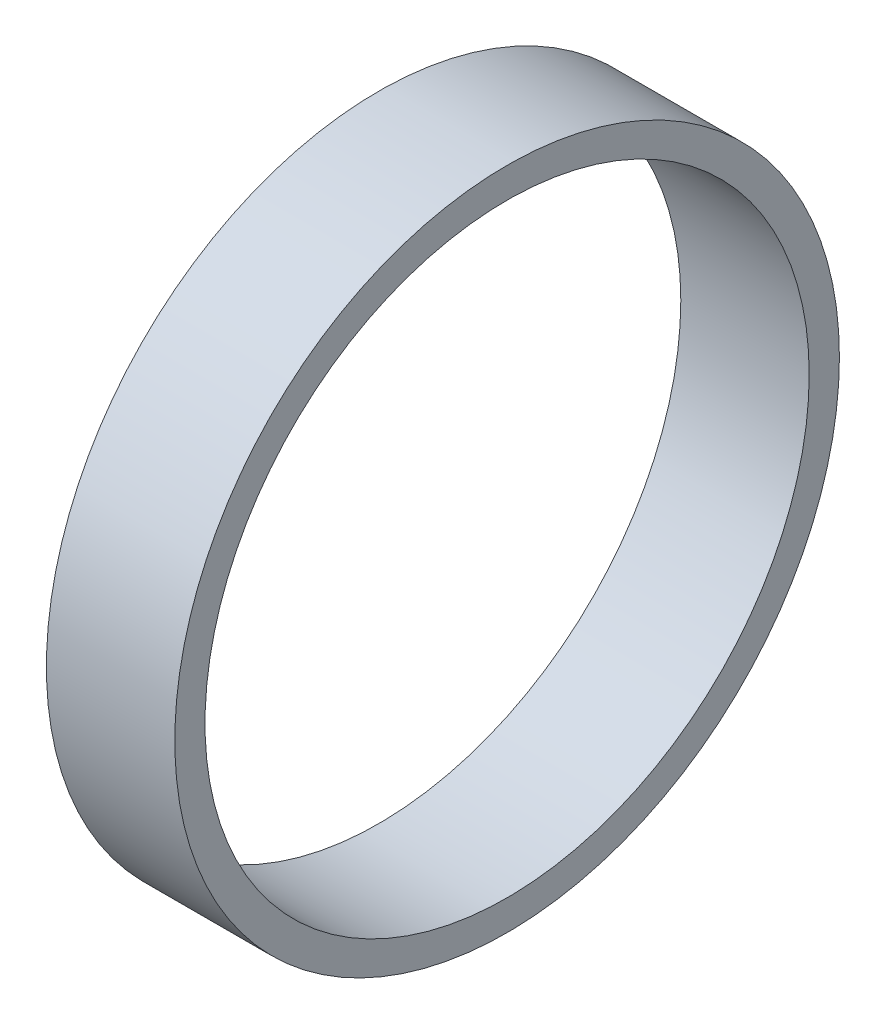
from build123d import *

# Parameters (mm, degrees)
ESBO_O1_R                = 11
ESBO_O1_R_2              = 10
RESSALTO_EXTRUS_O1_DEPTH = 4.25


with BuildPart() as part:
    # Esboço1 → Ressalto-extrusão1 (new body)
    with BuildSketch(Plane(origin=(0, 0, 0), x_dir=(0, 0, -1), z_dir=(1, 0, 0))):
        Circle(ESBO_O1_R)
        Circle(ESBO_O1_R_2, mode=Mode.SUBTRACT)
    extrude(amount=RESSALTO_EXTRUS_O1_DEPTH)


solid = part.part
